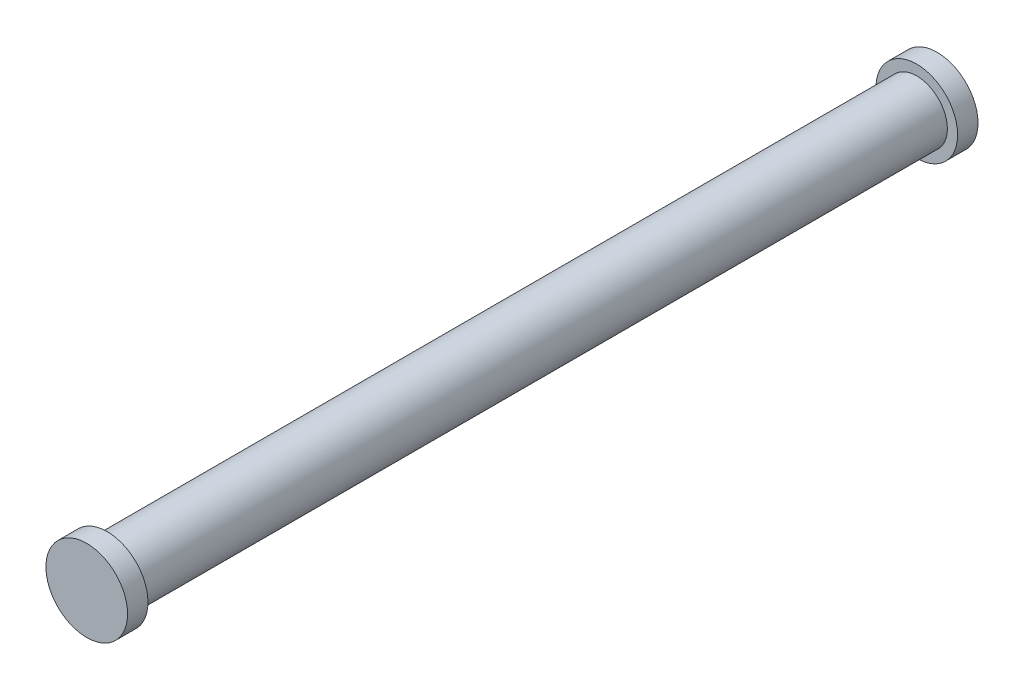
from build123d import *

# Parameters (mm, degrees)
SKETCH2_R           = 15
BOSS_EXTRUDE1_DEPTH = 198.335
SKETCH3_R           = 20
BOSS_EXTRUDE2_DEPTH = 10


with BuildPart() as part:
    # Sketch2 → Boss-Extrude1 (new, symmetric)
    with BuildSketch(Plane.XY):
        Circle(SKETCH2_R)
    extrude(amount=BOSS_EXTRUDE1_DEPTH, both=True)

    # Sketch3 → Boss-Extrude2 (add)
    with BuildSketch(Plane.XY.offset(198.335)):
        Circle(SKETCH3_R)
    boss_extrude2 = extrude(amount=BOSS_EXTRUDE2_DEPTH)

    # Mirror1: Boss-Extrude2 across plane
    add(boss_extrude2.mirror(Plane.XY))


solid = part.part
